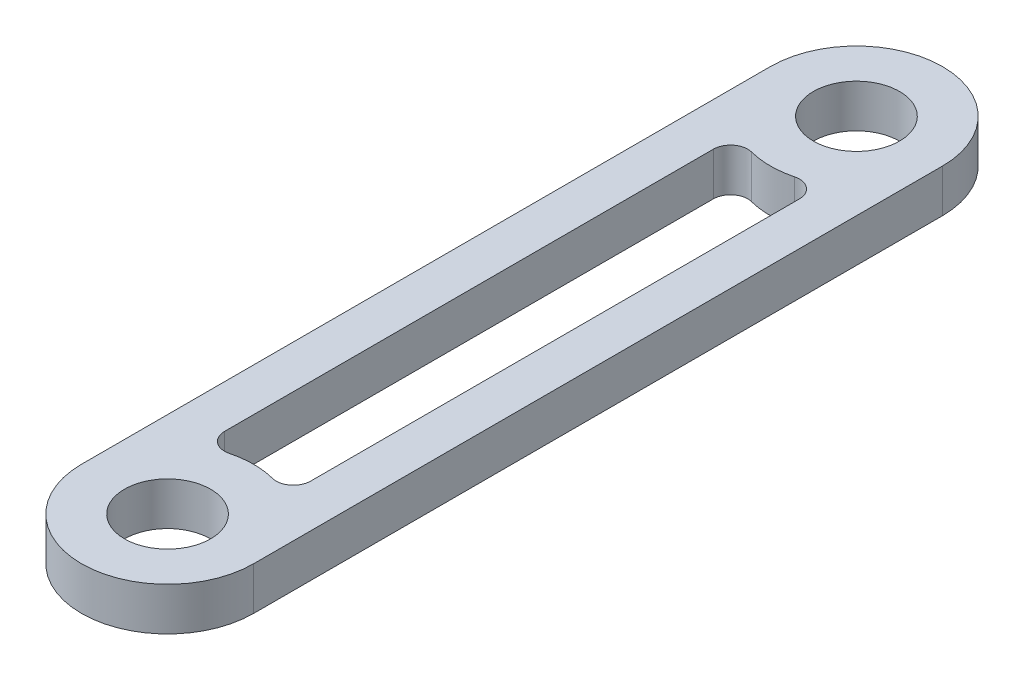
from build123d import *

# Parameters (mm, degrees)
SKETCH_1_R          = 5
EXTRUDE_1_DEPTH     = 5
CUT_EXTRUDE_1_DEPTH = 91.691785736
FILLET_1_R          = 2


with BuildPart() as part:
    # 草图1 → 凸台-拉伸1 (new body)
    with BuildSketch(Plane(origin=(0, 0, 0), x_dir=(1, 0, 0), z_dir=(0, 1, 0))):
        with BuildLine():
            Line((-10, 80), (-10, 0))
            ThreePointArc((-10, 0), (0, -10), (10, 0))
            Line((10, 0), (10, 80))
            ThreePointArc((10, 80), (0, 90), (-10, 80))
        make_face()
        with Locations(Location((0, 0, 0), (0, 0, 270))):
            Circle(SKETCH_1_R, mode=Mode.SUBTRACT)
        with Locations(Location((0, 80, 0), (0, 0, 270))):
            Circle(SKETCH_1_R, mode=Mode.SUBTRACT)
    extrude(amount=EXTRUDE_1_DEPTH)

    # 草图2 → 切除-拉伸1 (cut, through all)
    with BuildSketch(Plane(origin=(0, 5, 0), x_dir=(1, 0, 0), z_dir=(0, 1, 0))):
        with BuildLine():
            ThreePointArc((5, 71.339745962), (0, 70), (-5, 71.339745962))
            Line((-5, 71.339745962), (-5, 8.660254038))
            ThreePointArc((-5, 8.660254038), (0, 10), (5, 8.660254038))
            Line((5, 8.660254038), (5, 71.339745962))
        make_face()
    extrude(amount=-CUT_EXTRUDE_1_DEPTH, mode=Mode.SUBTRACT)

    # 圆角1
    fillet_1_edges = [part.edges().sort_by_distance(p)[0] for p in [
        (-5, 2.5, -71.339745962),
        (5, 2.5, -71.339745962),
        (5, 2.5, -8.660254038),
        (-5, 2.5, -8.660254038),
    ]]
    fillet(fillet_1_edges, radius=FILLET_1_R)


solid = part.part
